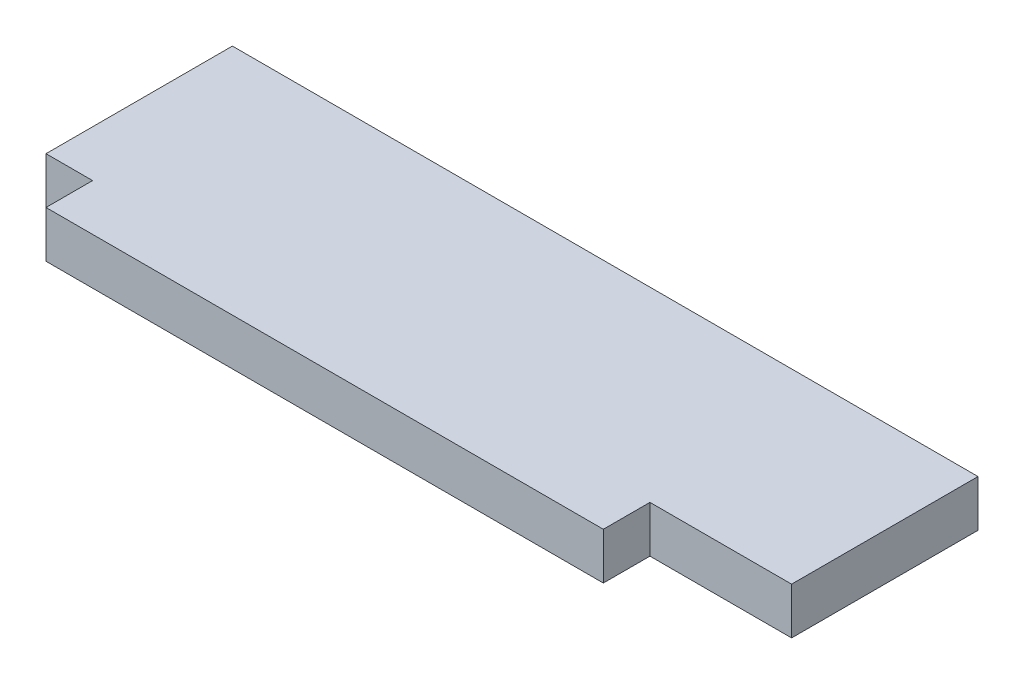
from build123d import *

# Parameters (mm, degrees)
SKETCH1_W           = 80
SKETCH1_H           = 20
SKETCH1_W_2         = 59.8
SKETCH1_H_2         = 5
BOSS_EXTRUDE1_DEPTH = 5


with BuildPart() as part:
    # Sketch1 → Boss-Extrude1 (new body)
    with BuildSketch(Plane(origin=(0, 0, 0), x_dir=(1, 0, 0), z_dir=(0, 1, 0))):
        with Locations((40, 10)):
            Rectangle(SKETCH1_W, SKETCH1_H)
        with Locations((34.9, -2.5)):
            Rectangle(SKETCH1_W_2, SKETCH1_H_2)
    extrude(amount=BOSS_EXTRUDE1_DEPTH)


solid = part.part
